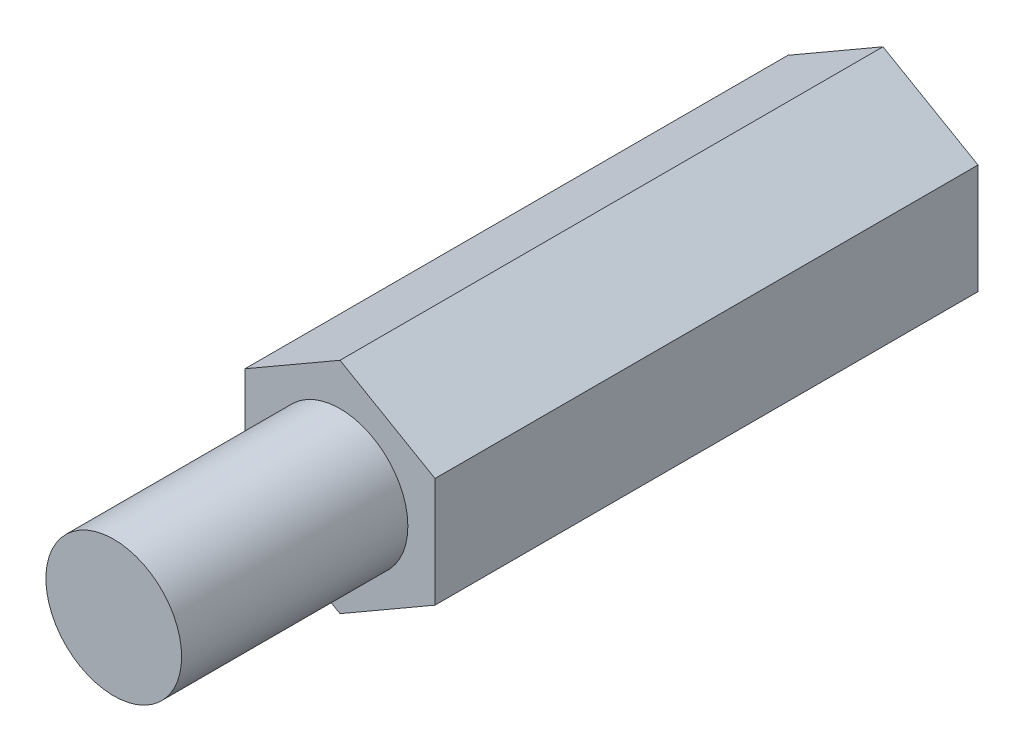
from build123d import *

# Parameters (mm, degrees)
SKETCH_1_R      = 1.5
EXTRUDE_1_DEPTH = 10
EXTRUDE_2_DEPTH = 2
SKETCH_3_R      = 1.5
EXTRUDE_3_DEPTH = 5


with BuildPart() as part:
    # 草图1 → 凸台-拉伸1 (new body)
    with BuildSketch(Plane.XY):
        Polygon((0, 2.424871131), (-2.1, 1.212435565), (-2.1, -1.212435565), (0, -2.424871131), (2.1, -1.212435565), (2.1, 1.212435565), align=None)
        Circle(SKETCH_1_R, mode=Mode.SUBTRACT)
    extrude(amount=EXTRUDE_1_DEPTH)

    # 草图2 → 凸台-拉伸2 (add)
    with BuildSketch(Plane.XY.offset(10)):
        Polygon((2.1, 1.212435565), (0, 2.424871131), (-2.1, 1.212435565), (-2.1, -1.212435565), (0, -2.424871131), (2.1, -1.212435565), align=None)
    extrude(amount=EXTRUDE_2_DEPTH)

    # 草图3 → 凸台-拉伸3 (add)
    with BuildSketch(Plane.XY.offset(12)):
        Circle(SKETCH_3_R)
    extrude(amount=EXTRUDE_3_DEPTH)


solid = part.part
